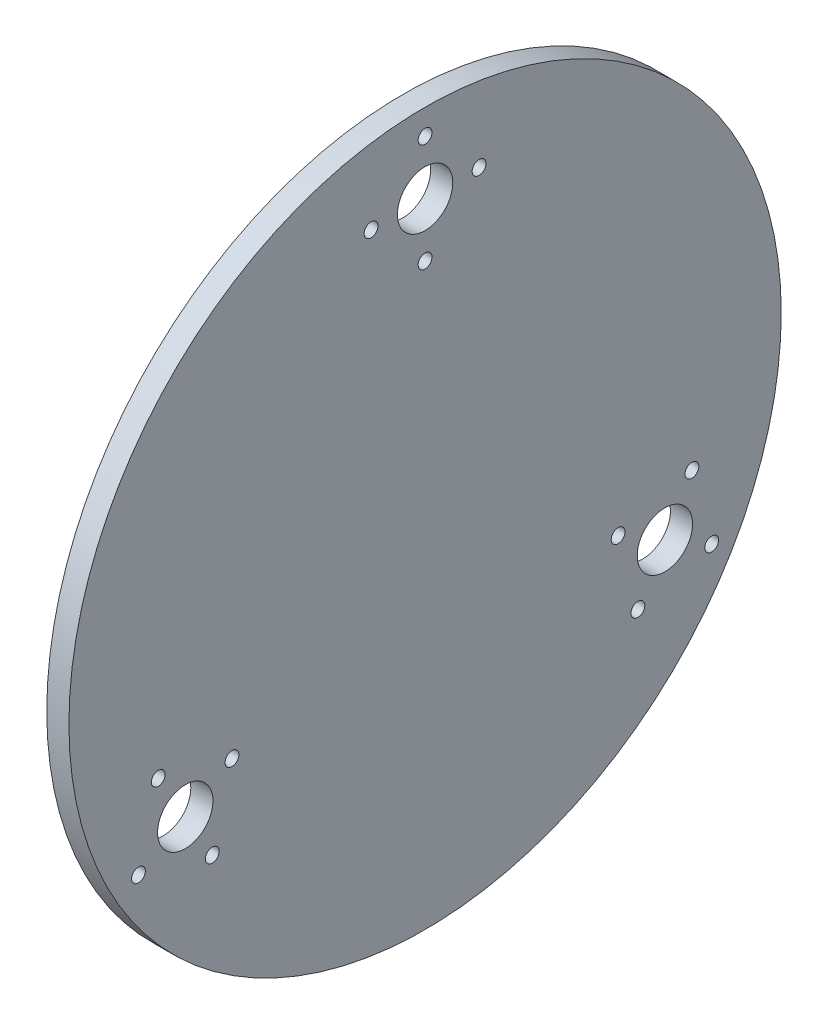
from build123d import *

# Parameters (mm, degrees)
SKETCH1_R           = 64.308589671
SKETCH1_R_2         = 1.25
SKETCH1_R_3         = 5
BOSS_EXTRUDE2_DEPTH = 4


with BuildPart() as part:
    # Sketch1 → Boss-Extrude2 (new body)
    with BuildSketch(Plane(origin=(0, 0, 0), x_dir=(0, 0, -1), z_dir=(1, 0, 0))):
        Circle(SKETCH1_R)
        with Locations((51.745017876, -29.875)):
            Circle(SKETCH1_R_2, mode=Mode.SUBTRACT)
        with Locations((0, 50)):
            Circle(SKETCH1_R_3, mode=Mode.SUBTRACT)
        with Locations((48.176270189, -16.556252313)):
            Circle(SKETCH1_R_2, mode=Mode.SUBTRACT)
        with Locations((43.301270189, -25)):
            Circle(SKETCH1_R_3, mode=Mode.SUBTRACT)
        with Locations((0, 59.75)):
            Circle(SKETCH1_R_2, mode=Mode.SUBTRACT)
        with Locations((9.75, 50)):
            Circle(SKETCH1_R_2, mode=Mode.SUBTRACT)
        with Locations((0, 40.25)):
            Circle(SKETCH1_R_2, mode=Mode.SUBTRACT)
        with Locations((-9.75, 50)):
            Circle(SKETCH1_R_2, mode=Mode.SUBTRACT)
        with Locations((38.426270189, -33.443747687)):
            Circle(SKETCH1_R_2, mode=Mode.SUBTRACT)
        with Locations((34.857522502, -20.125)):
            Circle(SKETCH1_R_2, mode=Mode.SUBTRACT)
        with Locations((-51.745017876, -29.875)):
            Circle(SKETCH1_R_2, mode=Mode.SUBTRACT)
        with Locations((-38.426270189, -33.443747687)):
            Circle(SKETCH1_R_2, mode=Mode.SUBTRACT)
        with Locations((-43.301270189, -25)):
            Circle(SKETCH1_R_3, mode=Mode.SUBTRACT)
        with Locations((-48.176270189, -16.556252313)):
            Circle(SKETCH1_R_2, mode=Mode.SUBTRACT)
        with Locations((-34.857522502, -20.125)):
            Circle(SKETCH1_R_2, mode=Mode.SUBTRACT)
    extrude(amount=BOSS_EXTRUDE2_DEPTH)


solid = part.part
